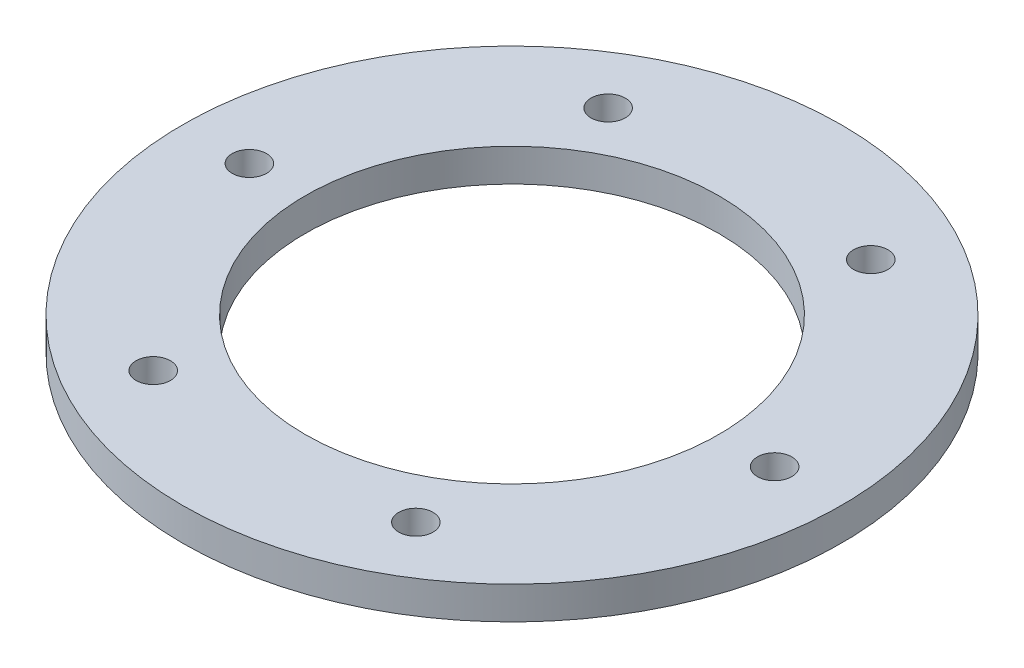
from build123d import *

# Parameters (mm, degrees)
SKETCH_1_W          = 15
SKETCH_1_H          = 4
SKETCH_2_R          = 2.1
CUT_EXTRUDE_1_DEPTH = 10


with BuildPart() as part:
    # 草图1 → 旋转1 (revolve)
    with BuildSketch(Plane.XY, mode=Mode.PRIVATE) as revolve_1_sk:
        with Locations((32.78, 2)):
            Rectangle(SKETCH_1_W, SKETCH_1_H)
    revolve(revolve_1_sk.sketch.rotate(Axis((0, 0, 0), (0, 1, 0)), 90), axis=Axis((0, 0, 0), (0, 1, 0)))

    # 草图2 → 切除-拉伸1 (cut)
    with BuildSketch(Plane(origin=(0, 4, 0), x_dir=(1, 0, 0), z_dir=(0, 1, 0))):
        with Locations(Location((-32.1, 0, 0), (0, 0, 270))):
            Circle(SKETCH_2_R)
        with Locations(Location((-16.05, 27.799415461, 0), (0, 0, 270))):
            Circle(SKETCH_2_R)
        with Locations(Location((16.05, 27.799415461, 0), (0, 0, 270))):
            Circle(SKETCH_2_R)
        with Locations(Location((32.1, 0, 0), (0, 0, 270))):
            Circle(SKETCH_2_R)
        with Locations(Location((16.05, -27.799415461, 0), (0, 0, 270))):
            Circle(SKETCH_2_R)
        with Locations(Location((-16.05, -27.799415461, 0), (0, 0, 270))):
            Circle(SKETCH_2_R)
    extrude(amount=-CUT_EXTRUDE_1_DEPTH, mode=Mode.SUBTRACT)


solid = part.part
